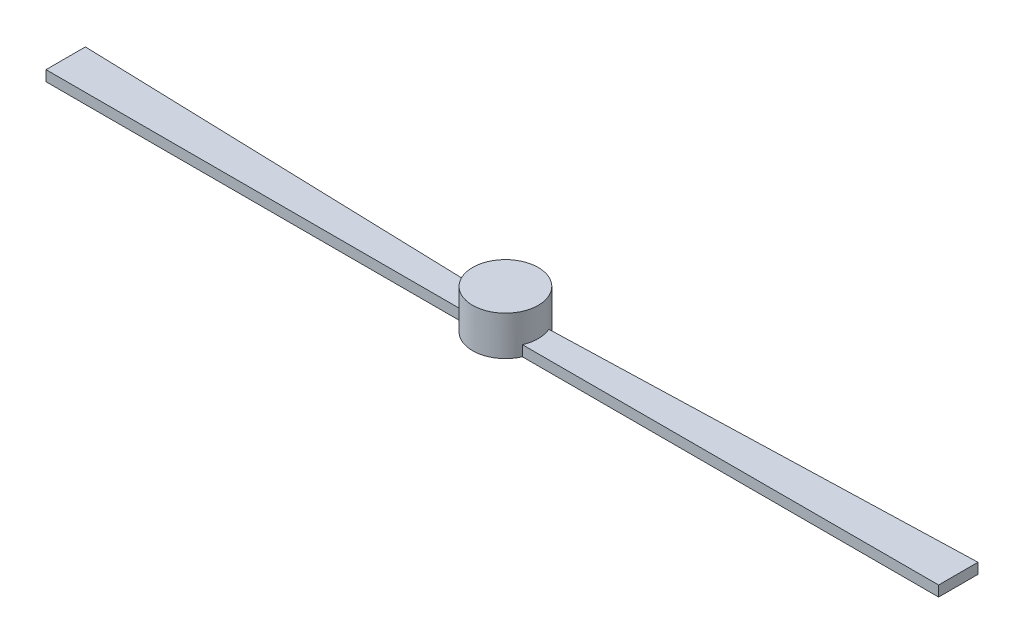
from build123d import *

# Parameters (mm, degrees)
SKETCH1_R           = 25
BOSS_EXTRUDE1_DEPTH = 30
BOSS_EXTRUDE2_DEPTH = 8


with BuildPart() as part:
    # Sketch1 → Boss-Extrude1 (new body)
    with BuildSketch(Plane(origin=(0, 0, 0), x_dir=(1, 0, 0), z_dir=(0, 1, 0))):
        with Locations(Location((0, 0, 0), (0, 0, 270))):
            Circle(SKETCH1_R)
    extrude(amount=BOSS_EXTRUDE1_DEPTH)

    # Sketch2 → Boss-Extrude2 (add)
    with BuildSketch(Plane(origin=(0, 0, 0), x_dir=(1, 0, 0), z_dir=(0, 1, 0))):
        Polygon((15, 10), (340, 20), (340, -10), (15, -10), align=None)
        Polygon((-15, 10), (-340, 20), (-340, -10), (-15, -10), align=None)
    extrude(amount=BOSS_EXTRUDE2_DEPTH)


solid = part.part
